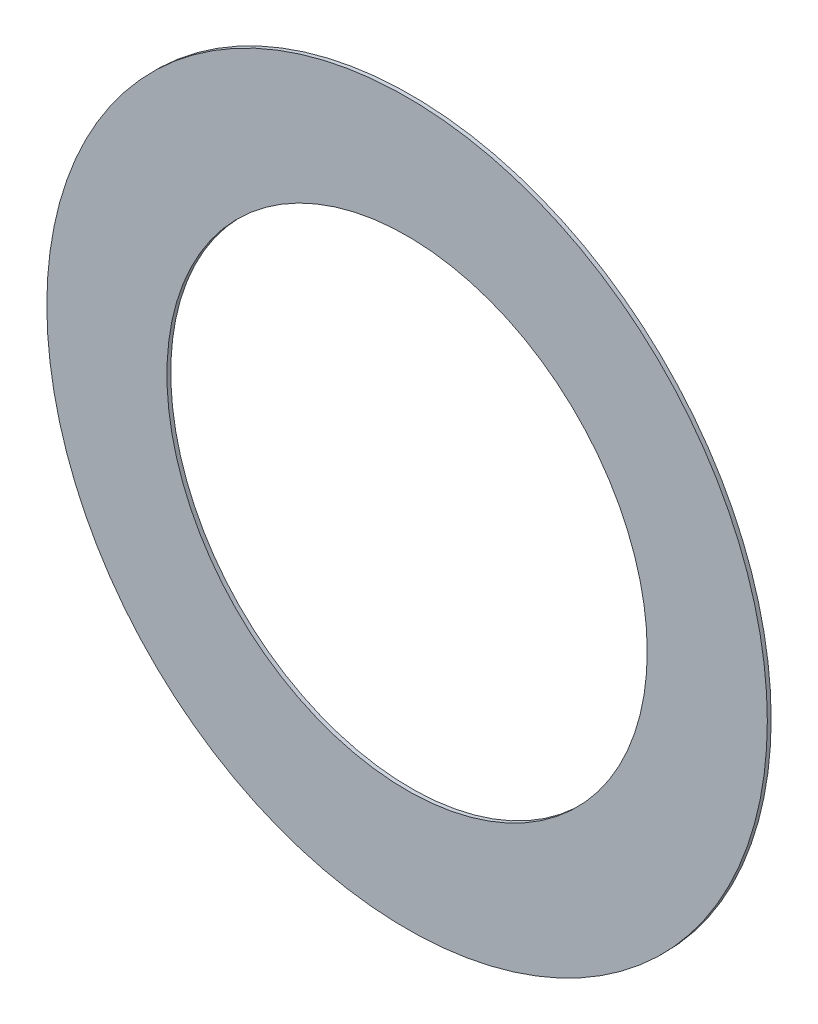
from build123d import *

# Parameters (mm, degrees)
SKETCH3_R           = 2.38125
SKETCH3_R_2         = 1.5875
BOSS_EXTRUDE1_DEPTH = 0.0127


with BuildPart() as part:
    # Sketch3 → Boss-Extrude1 (new, symmetric)
    with BuildSketch(Plane.XY):
        Circle(SKETCH3_R)
        Circle(SKETCH3_R_2, mode=Mode.SUBTRACT)
    extrude(amount=BOSS_EXTRUDE1_DEPTH, both=True)


solid = part.part
